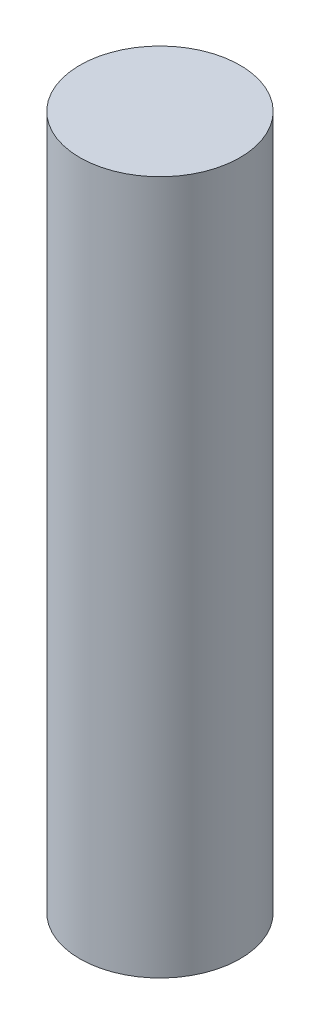
from build123d import *

# Parameters (mm, degrees)
SKETCH1_R           = 0.396875
BOSS_EXTRUDE1_DEPTH = 3.43916


with BuildPart() as part:
    # Sketch1 → Boss-Extrude1 (new body)
    with BuildSketch(Plane(origin=(0, 0, 0), x_dir=(1, 0, 0), z_dir=(0, 1, 0))):
        with Locations(Location((0, 0, 0), (0, 0, 270))):
            Circle(SKETCH1_R)
    extrude(amount=BOSS_EXTRUDE1_DEPTH)


solid = part.part
